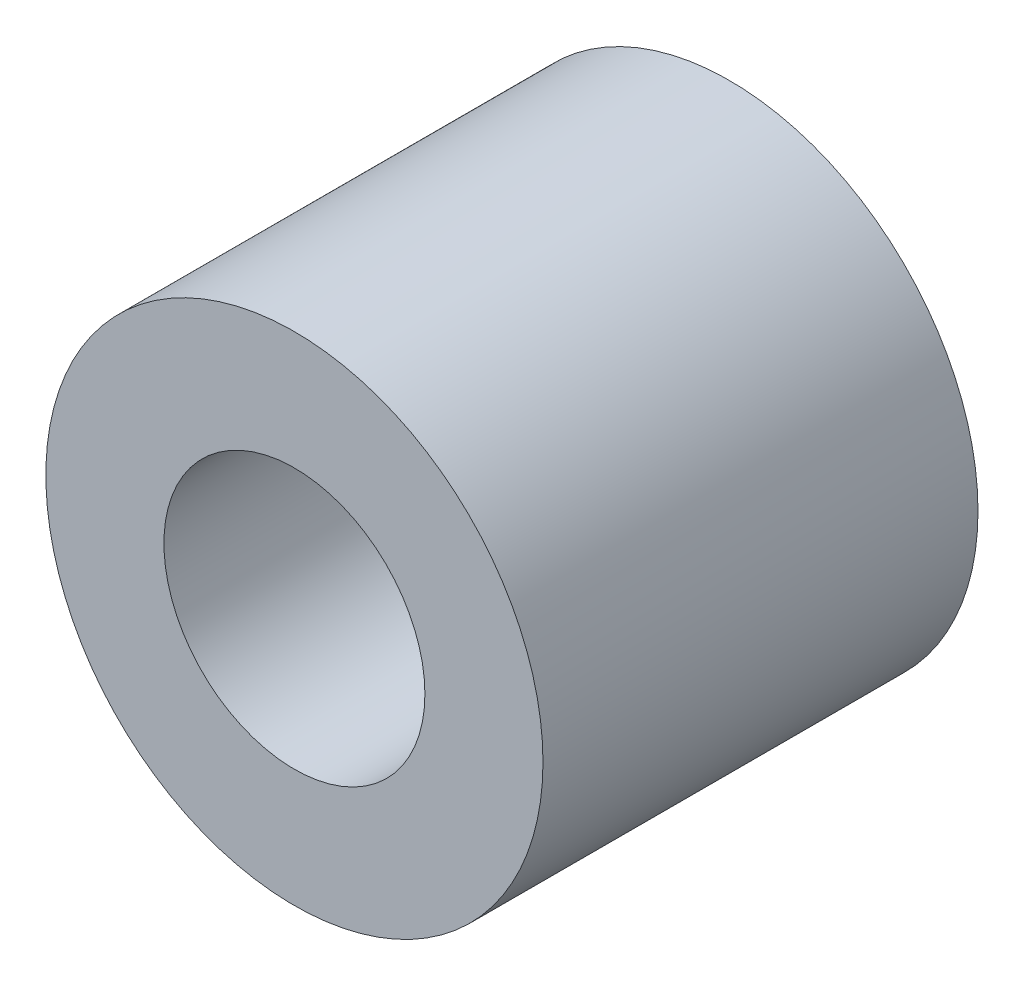
from build123d import *

# Parameters (mm, degrees)
SKETCH1_R           = 4
BOSS_EXTRUDE1_DEPTH = 7
SKETCH2_R           = 2.1
CUT_EXTRUDE1_DEPTH  = 10


with BuildPart() as part:
    # Sketch1 → Boss-Extrude1 (new body)
    with BuildSketch(Plane.XY):
        Circle(SKETCH1_R)
    extrude(amount=BOSS_EXTRUDE1_DEPTH)

    # Sketch2 → Cut-Extrude1 (cut, through all)
    with BuildSketch(Plane.XY.offset(7)):
        Circle(SKETCH2_R)
    extrude(amount=-CUT_EXTRUDE1_DEPTH, mode=Mode.SUBTRACT)


solid = part.part
